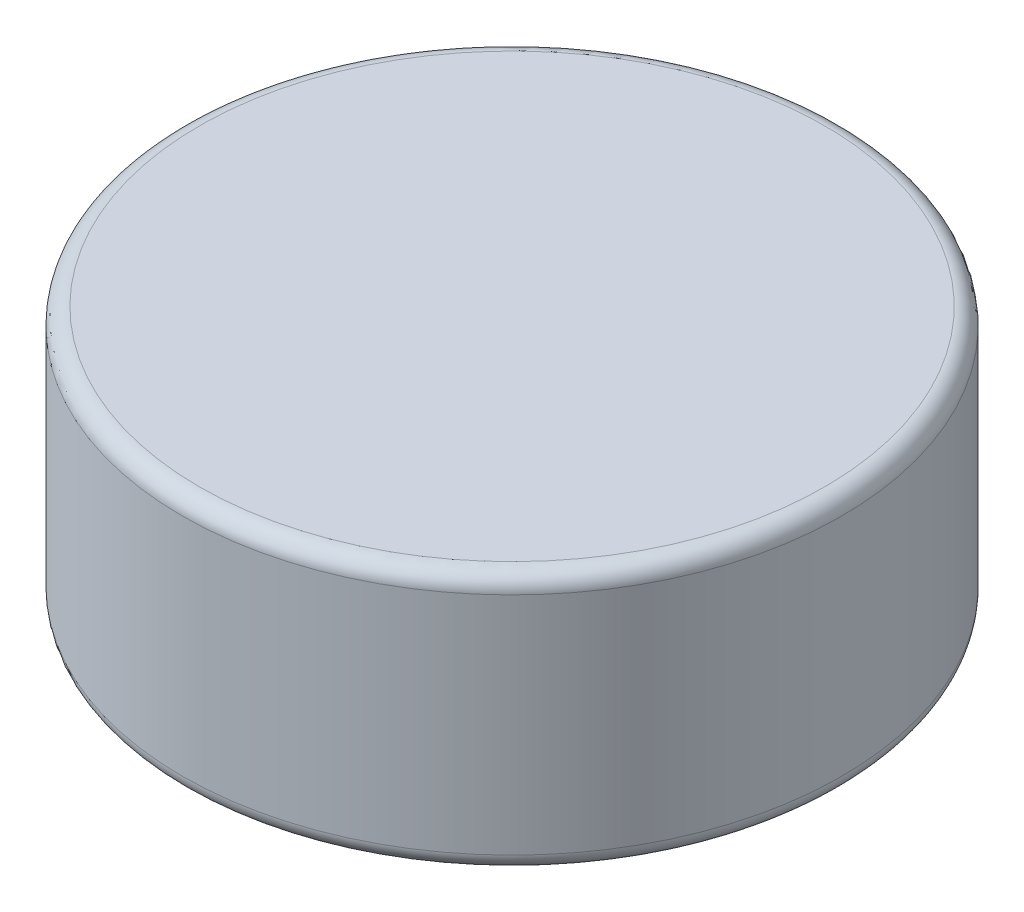
from build123d import *

# Parameters (mm, degrees)
SKETCH_1_R      = 58.5
EXTRUDE_1_DEPTH = 46
FILLET_1_R      = 3


with BuildPart() as part:
    # Эскиз1 → Бобышка-Вытянуть1 (new body)
    with BuildSketch(Plane(origin=(0, 0, 0), x_dir=(1, 0, 0), z_dir=(0, 1, 0))):
        with Locations(Location((0, 0, 0), (0, 0, 270))):
            Circle(SKETCH_1_R)
    extrude(amount=EXTRUDE_1_DEPTH)

    # Скругление1
    fillet_1_edges = [part.edges().sort_by_distance(p)[0] for p in [
        (0, 0, -58.5),
        (0, 46, -58.5),
    ]]
    fillet(fillet_1_edges, radius=FILLET_1_R)


solid = part.part
